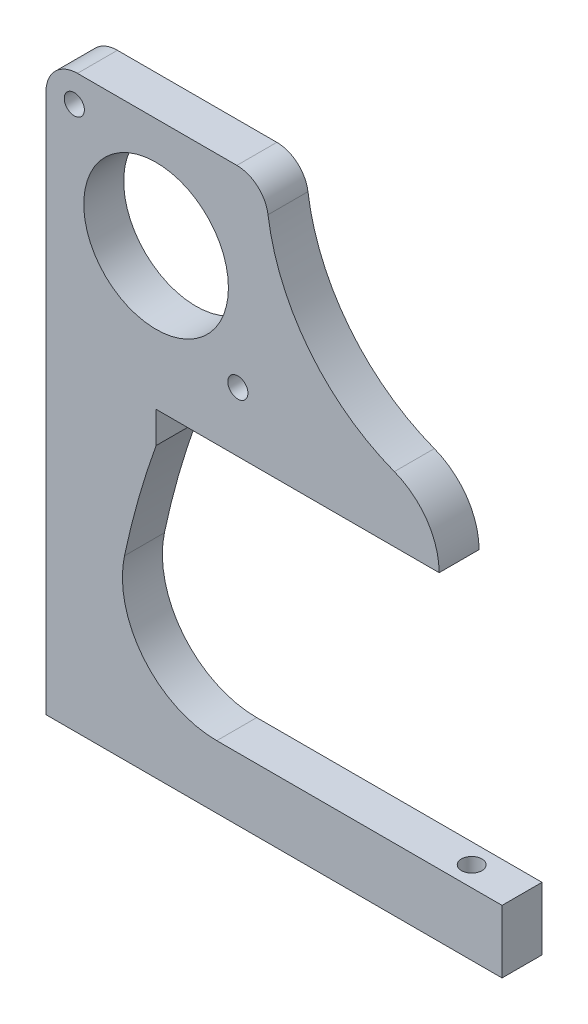
from build123d import *

# Parameters (mm, degrees)
SKETCH1_R                 = 1.6002
SKETCH1_R_2               = 11.5
BOSS_EXTRUDE1_DEPTH       = 6.35
F_6_32_TAPPED_HOLE1_D     = 3.25
F_6_32_TAPPED_HOLE1_DEPTH = 10
F_6_32_TAPPED_HOLE1_TIP   = 0.976398506
REDONDEO1_R               = 15
SKETCH1_4_W               = 10
SKETCH1_4_H               = 10
SALIENTE_EXTRUIR1_DEPTH   = 6.35
CORTAR_EXTRUIR1_REACH     = 118.367
CROQUIS1_R                = 1.625
REDONDEO2_R               = 5


with BuildPart() as part:
    # Sketch1 → Boss-Extrude1 (new body)
    with BuildSketch(Plane.XY):
        with BuildLine():
            Line((35, 0), (0, 0))
            Line((0, 0), (0, -40))
            Line((0, -40), (0, -90.8))
            Line((0, -90.8), (9.525, -90.8))
            Line((9.525, -90.8), (62.5, -90.8))
            Line((62.5, -90.8), (62.5, -80.8))
            Line((62.5, -80.8), (9.894504833, -80.8))
            ThreePointArc((9.894504833, -80.8), (12.482988146, -62.642036842), (17.5, -45))
            Line((17.5, -45), (17.5, -40))
            Line((17.5, -40), (62.5, -40))
            ThreePointArc((62.5, -40), (60.548464977, -33.716680328), (55.380636605, -29.644562334))
            ThreePointArc((55.380636605, -29.644562334), (40.586668907, -17.987290127), (35, 0))
        make_face()
        with Locations((30.5, -30.5)):
            Circle(SKETCH1_R, mode=Mode.SUBTRACT)
        with Locations((17.5, -17.5)):
            Circle(SKETCH1_R_2, mode=Mode.SUBTRACT)
        with Locations((4.5, -4.5)):
            Circle(SKETCH1_R, mode=Mode.SUBTRACT)
    extrude(amount=BOSS_EXTRUDE1_DEPTH)

    # #6-32 Tapped Hole1
    with Locations(Plane(origin=(0, -40, 0), x_dir=(-1, 0, 0), z_dir=(0, -1, 0))):
        with Locations((-22.58, -3.175), (-47.98, -3.175)):
            Hole(F_6_32_TAPPED_HOLE1_D / 2, depth=F_6_32_TAPPED_HOLE1_DEPTH)
            with Locations((0, 0, -(F_6_32_TAPPED_HOLE1_DEPTH + F_6_32_TAPPED_HOLE1_TIP / 2))):  # 118° drill point
                Cone(0, F_6_32_TAPPED_HOLE1_D / 2, F_6_32_TAPPED_HOLE1_TIP, mode=Mode.SUBTRACT)

    # Redondeo1
    redondeo1_edges = [part.edges().sort_by_distance(p)[0] for p in [
        (9.894504833, -80.8, 3.175),
    ]]
    fillet(redondeo1_edges, radius=REDONDEO1_R)

    # Sketch1<4> → Saliente-Extruir1 (add)
    with BuildSketch(Plane.XY):
        with Locations((67.5, -85.8)):
            Rectangle(SKETCH1_4_W, SKETCH1_4_H)
    extrude(amount=SALIENTE_EXTRUIR1_DEPTH)

    # Croquis1 → Cortar-Extruir1 (cut, up to next)
    with BuildSketch(Plane.XZ.offset(90.8), mode=Mode.PRIVATE) as cortar_extruir1_sk1:
        with Locations((64.5, 3.175)):
            Circle(CROQUIS1_R)
    cortar_extruir1_tool1 = extrude(cortar_extruir1_sk1.sketch, amount=-CORTAR_EXTRUIR1_REACH, mode=Mode.PRIVATE) & part.part
    add(cortar_extruir1_tool1.solids().sort_by_distance((64.5, -90.8, 3.175))[0], mode=Mode.SUBTRACT)

    # Redondeo2
    redondeo2_edges = [part.edges().sort_by_distance(p)[0] for p in [
        (0, 0, 3.175),
        (35, 0, 3.175),
    ]]
    fillet(redondeo2_edges, radius=REDONDEO2_R)


solid = part.part
